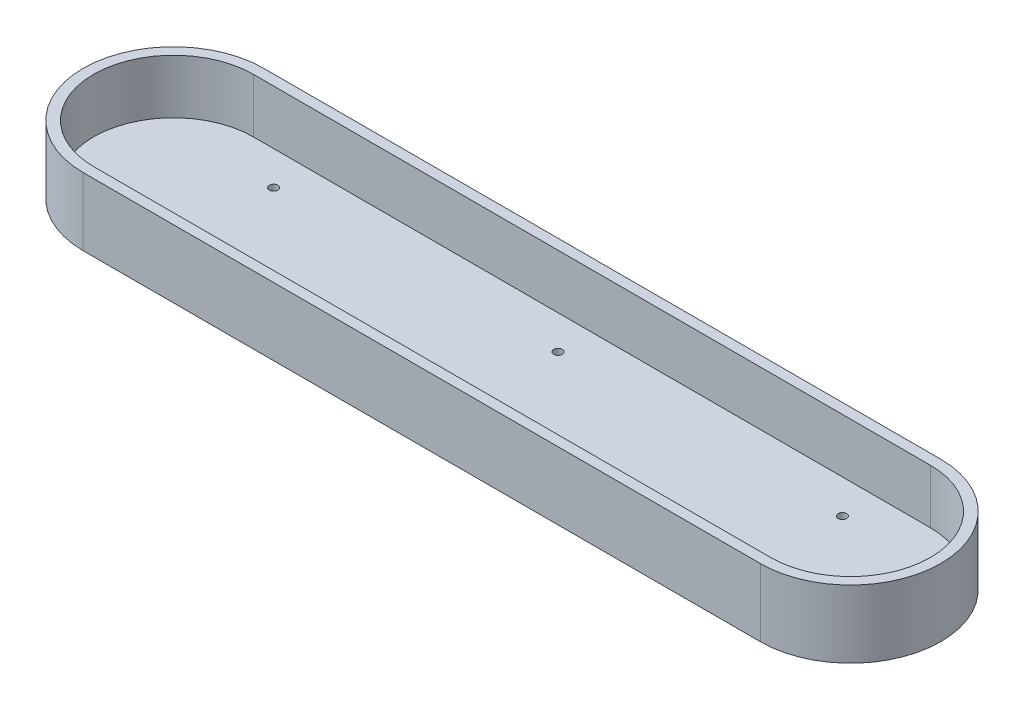
from build123d import *

# Parameters (mm, degrees)
MAINBLOCK_DEPTH     = 3.81
BOSS_EXTRUDE1_DEPTH = 19.05
SKETCH3_R           = 1.2065
CUT_EXTRUDE1_DEPTH  = 125.757705173


with BuildPart() as part:
    # Sketch1 → MainBlock (new body)
    with BuildSketch(Plane(origin=(0, 0, 0), x_dir=(1, 0, 0), z_dir=(0, 1, 0))):
        with BuildLine():
            Line((-95.25, 22.479), (95.25, 22.479))
            ThreePointArc((95.25, 22.479), (117.729, 0), (95.25, -22.479))
            Line((95.25, -22.479), (-95.25, -22.479))
            ThreePointArc((-95.25, -22.479), (-117.729, 0), (-95.25, 22.479))
        make_face()
    extrude(amount=MAINBLOCK_DEPTH)

    # Sketch2 → Boss-Extrude1 (add)
    with BuildSketch(Plane.XZ):
        with BuildLine():
            Line((-95.25, 25.4), (95.25, 25.4))
            ThreePointArc((95.25, 25.4), (120.65, 0), (95.25, -25.4))
            Line((95.25, -25.4), (-95.25, -25.4))
            ThreePointArc((-95.25, -25.4), (-120.65, 0), (-95.25, 25.4))
        make_face()
        with BuildLine():
            Line((95.25, 22.479), (-95.25, 22.479))
            ThreePointArc((-95.25, 22.479), (-117.729, 0), (-95.25, -22.479))
            Line((-95.25, -22.479), (95.25, -22.479))
            ThreePointArc((95.25, -22.479), (117.729, 0), (95.25, 22.479))
        make_face(mode=Mode.SUBTRACT)
    extrude(amount=-BOSS_EXTRUDE1_DEPTH)

    # Sketch3 → Cut-Extrude1 (cut, through all)
    with BuildSketch(Plane.XZ):
        with Locations(Location((0, 12.954, 0), (0, 0, 270))):
            Circle(SKETCH3_R)
        with Locations(Location((-80.01, 12.954, 0), (0, 0, 270))):
            Circle(SKETCH3_R)
        with Locations(Location((80.01, 12.954, 0), (0, 0, 270))):
            Circle(SKETCH3_R)
        with Locations(Location((80.01, -12.954, 0), (0, 0, 270))):
            Circle(SKETCH3_R)
        with Locations(Location((-80.01, -12.954, 0), (0, 0, 270))):
            Circle(SKETCH3_R)
        with Locations(Location((0, -12.954, 0), (0, 0, 270))):
            Circle(SKETCH3_R)
    extrude(amount=-CUT_EXTRUDE1_DEPTH, mode=Mode.SUBTRACT)


solid = part.part
